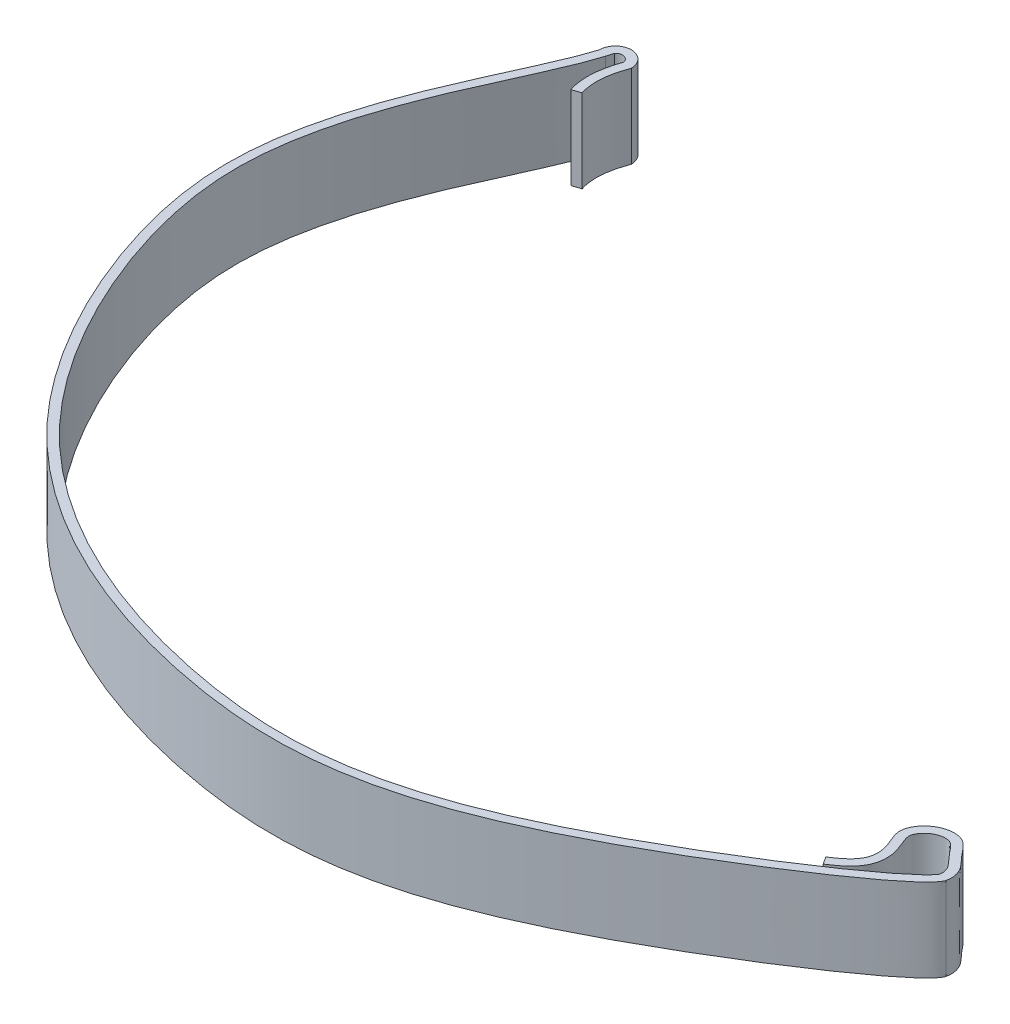
from build123d import *

# Parameters (mm, degrees)
BOSS_EXTRUDE1_DEPTH = 14


with BuildPart() as part:
    # Sketch1 → Boss-Extrude1 (new body)
    with BuildSketch(Plane(origin=(0, 0, 0), x_dir=(1, 0, 0), z_dir=(0, 1, 0))):
        with BuildLine():
            add(Edge.make_bspline(
                [(94.006665642, 10.939837252), (94.04712513, 11.101048121), (94.080001635, 11.41918493), (93.991777662, 11.996762347), (93.787807963, 12.493442311), (93.435024853, 12.986749788), (92.876442091, 13.587633125), (92.157426654, 14.368134053), (91.543987978, 15.157850091), (91.009634752, 15.815988481), (90.520779009, 16.29316324), (90.143666007, 16.533575964), (89.679905117, 16.674784655), (88.874954008, 16.716749902), (87.733578957, 16.421676062), (86.737022973, 15.661964266), (86.1845488, 14.929616595), (85.935859164, 14.385298389), (85.856963463, 13.947276088), (85.90232533, 13.532684956), (86.120355624, 12.859272184), (86.477084037, 12.029959368), (86.878445199, 11.026969112), (87.165005426, 9.850358921), (87.240505039, 8.649997684), (87.081894139, 7.418363225), (86.610097435, 6.224381863), (85.938194166, 5.24262753), (85.157523267, 4.412061381), (84.330546195, 3.710662094), (83.491351075, 3.103714309), (82.995126164, 2.778555987), (82.735470542, 2.611613181)],
                knots=[0.000545476, 0.000545476, 0.000545476, 0.000545476, 0.03177843, 0.063011384, 0.094244338, 0.125477292, 0.156710246, 0.1879432, 0.219176154, 0.250409107, 0.281642061, 0.312875015, 0.344107969, 0.375340923, 0.437806831, 0.500272738, 0.531505692, 0.562738646, 0.5939716, 0.625204554, 0.656437508, 0.687670461, 0.718903415, 0.750136369, 0.781369323, 0.812602277, 0.843835231, 0.875068185, 0.906301138, 0.937534092, 0.968767046, 1, 1, 1, 1], degree=3))
            Line((82.735470542, 2.611613181), (81.924260801, 3.873333735))
            add(Edge.make_bspline(
                [(95.457646383, 10.559334609), (95.678294013, 11.419474533), (95.372206008, 13.324665847), (93.110410236, 15.331058361), (91.205576207, 18.475913036), (86.527622275, 18.159220098), (83.43348914, 14.13991517), (85.712005839, 10.731158476), (85.861546258, 6.555038865), (83.254874795, 4.728837776), (81.924260801, 3.873333735)],
                knots=[0, 0, 0, 0, 0.091657379, 0.181034921, 0.308669681, 0.43913342, 0.597159991, 0.725260511, 0.823505514, 1, 1, 1, 1], degree=3))
            add(Edge.make_bspline(
                [(-54.812058422, 102.495709451), (-57.601369352, 93.095240259), (-70.815452987, 72.629926609), (-68.801239746, 37.121715581), (-48.909767922, -7.404164104), (9.542461447, -29.925803296), (48.292396622, -23.112968399), (94.732742213, 7.561668649), (95.457646383, 10.559334609)],
                knots=[0, 0, 0, 0, 0.23059041, 0.273327635, 0.427372251, 0.626139474, 0.858257947, 1, 1, 1, 1], degree=3))
            ThreePointArc((-54.812058422, 102.495709451), (-52.127167438, 105.180600436), (-49.442276453, 102.495709451))
            add(Edge.make_bspline(
                [(-49.442276453, 102.495709451), (-50.368670783, 100.076071934), (-50.824839325, 97.277792176), (-49.989975312, 94.761422105)],
                knots=[0, 0, 0, 0, 1, 1, 1, 1], degree=3))
            Line((-49.989975312, 94.761422105), (-51.413665222, 94.289080026))
            add(Edge.make_bspline(
                [(-51.413665222, 94.289080026), (-51.646784966, 94.991728048), (-51.947843686, 96.471336744), (-51.942935035, 98.636246075), (-51.594687008, 100.749944969), (-51.197532108, 102.062748831), (-50.962238736, 102.712291458)],
                knots=[0.040294955, 0.040294955, 0.040294955, 0.040294955, 0.280221217, 0.520147478, 0.760073739, 1, 1, 1, 1], degree=3))
            ThreePointArc((-50.962238736, 102.712291458), (-51.822896639, 103.64086705), (-53.03095697, 103.261954273))
            Line((-53.03095697, 103.261954273), (-53.37402748, 102.069016342))
            add(Edge.make_bspline(
                [(-53.37402748, 102.069016342), (-53.476437788, 101.723875566), (-53.690829709, 101.050324623), (-54.196586291, 99.616494324), (-54.941261355, 97.729423669), (-55.987529151, 95.291462541), (-57.539472301, 91.824472464), (-59.691401248, 87.100425161), (-62.343619988, 80.888280731), (-64.795532586, 74.222218554), (-66.77718046, 67.20453647), (-68.024970481, 59.911449953), (-68.271447981, 52.521435328), (-67.314355933, 44.653659349), (-65.032250758, 35.872329415), (-61.547951087, 26.734768188), (-56.966777323, 17.655342964), (-51.403673908, 9.065162264), (-44.985262437, 1.433847284), (-37.811563564, -4.985831746), (-27.487278247, -12.118636687), (-13.642482821, -18.525554148), (2.967912024, -22.840518157), (17.802831803, -24.446531248), (29.727889044, -23.232848248), (39.818090915, -20.500811996), (47.838984107, -17.506218918), (55.051929803, -14.169782935), (61.22133513, -10.969010774), (67.700572496, -7.395571497), (74.35458379, -3.443471442), (80.532172288, 0.482717186), (84.766841379, 3.314130093), (87.827257036, 5.493637693), (89.909868869, 7.074780187), (91.266404921, 8.164209034), (92.393202797, 9.139510357), (93.117645391, 9.838361049), (93.550127199, 10.308220763), (93.795500226, 10.607330345), (93.926868759, 10.795857352), (93.989074914, 10.90332757), (93.999765162, 10.924646424), (94.006665642, 10.939837252)],
                knots=[0, 0, 0, 0, 0.007784918, 0.015569836, 0.031139672, 0.046709508, 0.062279344, 0.093419016, 0.124558688, 0.15569836, 0.186838033, 0.217977705, 0.249117377, 0.280257049, 0.311396721, 0.342536393, 0.373676065, 0.404815737, 0.435955409, 0.467095081, 0.498234753, 0.560514098, 0.622793442, 0.685072786, 0.74735213, 0.778491802, 0.809631474, 0.840771146, 0.856340982, 0.871910818, 0.90305049, 0.918620327, 0.934190163, 0.949759999, 0.957544917, 0.965329835, 0.973114753, 0.980899671, 0.98479213, 0.988684589, 0.992577048, 0.994523277, 0.996469507, 0.996469507, 0.996469507, 0.996469507], degree=3))
        make_face()
    extrude(amount=BOSS_EXTRUDE1_DEPTH)


solid = part.part
